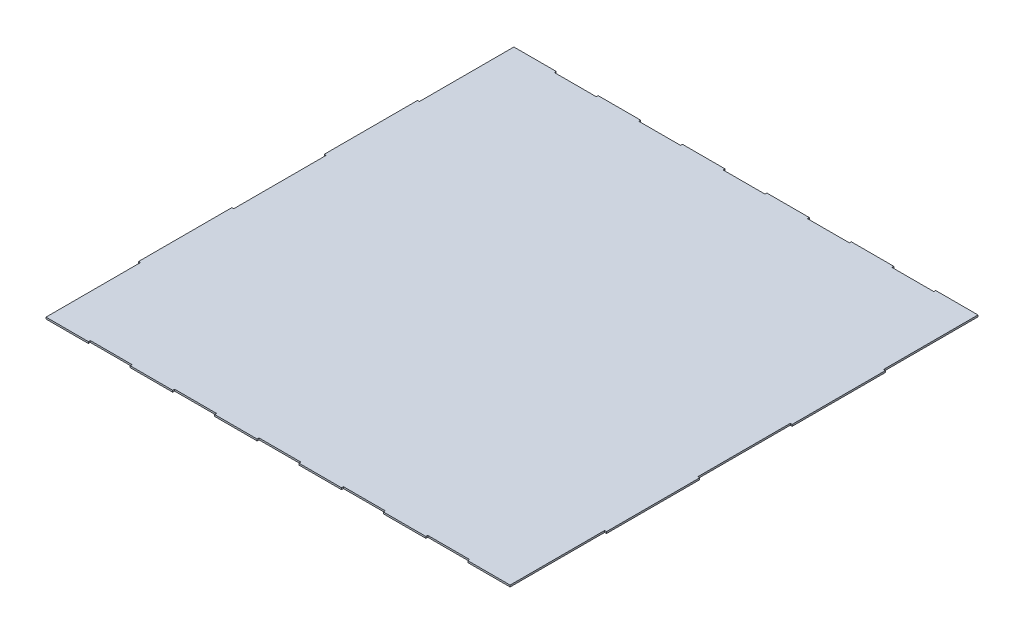
from build123d import *

# Parameters (mm, degrees)
BOSS_EXTRUDE1_DEPTH = 1.6


with BuildPart() as part:
    # oneSide → Boss-Extrude1 (new body)
    with BuildSketch(Plane(origin=(0, 0, 0), x_dir=(1, 0, 0), z_dir=(0, 1, 0))):
        Polygon((-216.6666645, 216.6666645), (-216.6666645, 218.4266645), (-177.1127255, 218.4266645), (-177.1127255, 216.6666645), (-138.0387865, 216.6666645), (-138.0387865, 218.4266645), (-98.3248475, 218.4266645), (-98.3248475, 216.6666645), (-59.2509085, 216.6666645), (-59.2509085, 218.4266645), (-19.5369695, 218.4266645), (-19.5369695, 216.6666645), (19.5369695, 216.6666645), (19.5369695, 218.4266645), (59.2509085, 218.4266645), (59.2509085, 216.6666645), (98.3248475, 216.6666645), (98.3248475, 218.4266645), (138.0387865, 218.4266645), (138.0387865, 216.6666645), (177.1127255, 216.6666645), (177.1127255, 218.4266645), (216.6666645, 218.4266645), (216.6666645, 216.6666645), (216.6666645, 130.1599987), (218.4266645, 130.1599987), (218.4266645, 43.1733329), (216.6666645, 43.1733329), (216.6666645, 0), (-216.6666645, 0), (-216.6666645, 43.1733329), (-218.4266645, 43.1733329), (-218.4266645, 130.1599987), (-216.6666645, 130.1599987), align=None)
    boss_extrude1 = extrude(amount=BOSS_EXTRUDE1_DEPTH)

    # Mirror1: Boss-Extrude1 across plane
    add(boss_extrude1.mirror(Plane(origin=(216.6666645, 1.6, 0), x_dir=(1, 0, 0), z_dir=(0, 0, -1))))


solid = part.part
